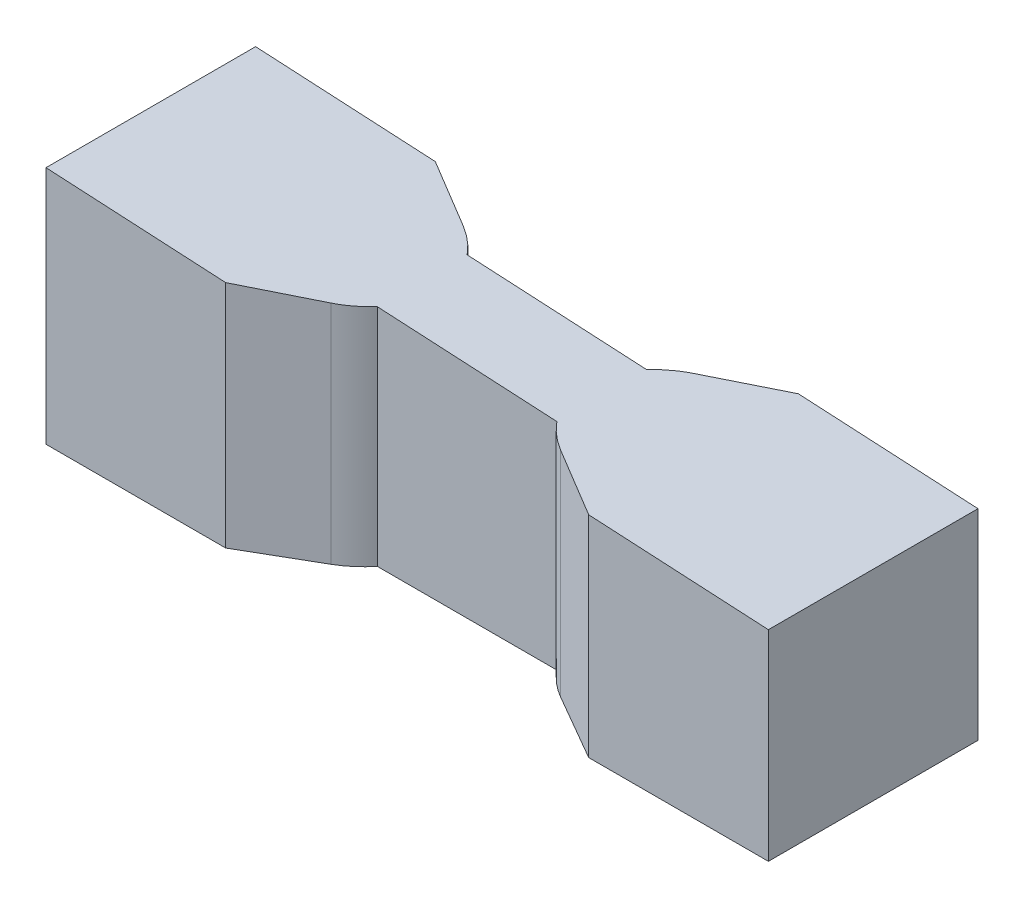
from build123d import *

# Parameters (mm, degrees)
BOSS_EXTRUDE1_DEPTH     = 8
BOSS_EXTRUDE1_2_DEPTH   = 8
BOSS_EXTRUDE2_DEPTH     = 8
CUT_EXTRUDE2_DEPTH      = 15.891142801
CUT_EXTRUDE2_DEPTH_BACK = 15.891142801


with BuildPart() as part:
    # Sketch2 → Boss-Extrude1 (new body)
    with BuildSketch(Plane(origin=(0, 0, 0), x_dir=(1, 0, 0), z_dir=(0, 1, 0))):
        with BuildLine():
            Line((-6.062177826, 3.5), (-12.062177826, 3.5))
            Line((-12.062177826, 3.5), (-12.062177826, -3.5))
            Line((-12.062177826, -3.5), (-6.062177826, -3.5))
            Line((-6.062177826, -3.5), (-3.834419723, -2.213803259))
            ThreePointArc((-3.834419723, -2.213803259), (-3.384272952, -1.895404124), (-3, -1.5))
            Line((-3, -1.5), (-3, 1.5))
            ThreePointArc((-3, 1.5), (-3.384272952, 1.895404124), (-3.834419723, 2.213803259))
            Line((-3.834419723, 2.213803259), (-6.062177826, 3.5))
        make_face()
    extrude(amount=BOSS_EXTRUDE1_DEPTH)



with BuildPart() as body_2:
    # Sketch2 → Boss-Extrude1 2 (new body)
    with BuildSketch(Plane(origin=(0, 0, 0), x_dir=(1, 0, 0), z_dir=(0, 1, 0))):
        with BuildLine():
            Line((3.834419723, 2.213803259), (6.062177826, 3.5))
            Line((6.062177826, 3.5), (12.062177826, 3.5))
            Line((12.062177826, 3.5), (12.062177826, -3.5))
            Line((12.062177826, -3.5), (6.062177826, -3.5))
            Line((6.062177826, -3.5), (3.834419723, -2.213803259))
            ThreePointArc((3.834419723, -2.213803259), (3.384272952, -1.895404124), (3, -1.5))
            Line((3, -1.5), (3, 1.5))
            ThreePointArc((3, 1.5), (3.384272952, 1.895404124), (3.834419723, 2.213803259))
        make_face()
    extrude(amount=BOSS_EXTRUDE1_2_DEPTH)


with BuildPart() as part_1:
    add(part.part)

    add(body_2.part)  # Boss-Extrude2 merges body 2
    # Sketch1 → Boss-Extrude2 (add)
    with BuildSketch(Plane(origin=(0, 0, 0), x_dir=(1, 0, 0), z_dir=(0, 1, 0))):
        with BuildLine():
            Line((3, -1.5), (-3, -1.5))
            ThreePointArc((-3, -1.5), (-3.898777162, -2.249912014), (-5.016117889, -2.598793246))
            ThreePointArc((-5.016117889, -2.598793246), (-5.630991226, -2.399814505), (-5.894085249, -1.809523648))
            Line((-5.894085249, -1.809523648), (-5.894085249, 1.809523648))
            ThreePointArc((-5.894085249, 1.809523648), (-5.630991226, 2.399814505), (-5.016117889, 2.598793246))
            ThreePointArc((-5.016117889, 2.598793246), (-3.898777162, 2.249912014), (-3, 1.5))
            Line((-3, 1.5), (3, 1.5))
            ThreePointArc((3, 1.5), (3.898777162, 2.249912014), (5.016117889, 2.598793246))
            ThreePointArc((5.016117889, 2.598793246), (5.630991226, 2.399814505), (5.894085249, 1.809523648))
            Line((5.894085249, 1.809523648), (5.894085249, -1.809523648))
            ThreePointArc((5.894085249, -1.809523648), (5.630991226, -2.399814505), (5.016117889, -2.598793246))
            ThreePointArc((5.016117889, -2.598793246), (3.898777162, -2.249912014), (3, -1.5))
        make_face()
    extrude(amount=BOSS_EXTRUDE2_DEPTH)

    # Sketch4 → Cut-Extrude2 (cut, two sides: drawn at the far end of the back side and taken through both)
    with BuildSketch(Plane.XY.offset(-CUT_EXTRUDE2_DEPTH_BACK)):
        Polygon((12.062177826, 8), (12.062177826, 6.7), (-12.062177826, 8), align=None)
    extrude(amount=CUT_EXTRUDE2_DEPTH + CUT_EXTRUDE2_DEPTH_BACK, mode=Mode.SUBTRACT)


solid = part_1.part
